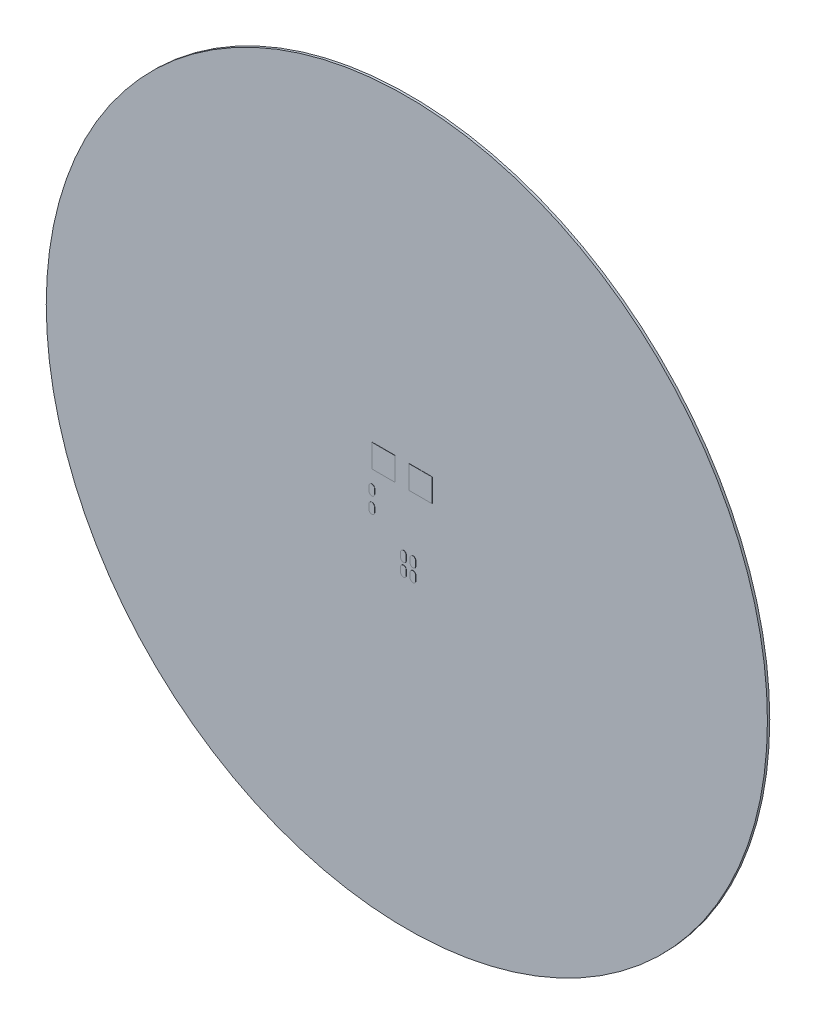
from build123d import *

# Parameters (mm, degrees)
SKETCH1_R           = 155
BOSS_EXTRUDE1_DEPTH = 1
SKETCH2_W           = 9.944482202
SKETCH2_H           = 9.944482203
BOSS_EXTRUDE2_DEPTH = 0.1


with BuildPart() as part:
    # Sketch1 → Boss-Extrude1 (new body)
    with BuildSketch(Plane.XY):
        Circle(SKETCH1_R)
    extrude(amount=BOSS_EXTRUDE1_DEPTH)

    # Sketch2 → Boss-Extrude2 (add)
    with BuildSketch(Plane.XY.offset(1)):
        with Locations((-10, 13.832433297)):
            Rectangle(SKETCH2_W, SKETCH2_H)
        with Locations((6, 13.832433297)):
            Rectangle(SKETCH2_W, SKETCH2_H)
        with BuildLine():
            Line((-13.779336212, 2.051462451), (-13.779336212, 0))
            ThreePointArc((-13.779336212, 0), (-14.972241101, -1.19290489), (-16.165145991, 0))
            Line((-16.165145991, 0), (-16.165145991, 2.051462451))
            ThreePointArc((-16.165145991, 2.051462451), (-14.972241101, 3.244367341), (-13.779336212, 2.051462451))
        make_face()
        with BuildLine():
            Line((-16.165145991, -6.802865473), (-16.165145991, -4.751403022))
            ThreePointArc((-16.165145991, -4.751403022), (-14.972241101, -3.558498133), (-13.779336212, -4.751403022))
            Line((-13.779336212, -4.751403022), (-13.779336212, -6.802865473))
            ThreePointArc((-13.779336212, -6.802865473), (-14.972241101, -7.995770363), (-16.165145991, -6.802865473))
        make_face()
        with BuildLine():
            Line((-0.185839603, -15.881052977), (-0.185839603, -17.932515427))
            ThreePointArc((-0.185839603, -17.932515427), (-1.378744492, -19.125420317), (-2.571649382, -17.932515427))
            Line((-2.571649382, -17.932515427), (-2.571649382, -15.881052977))
            ThreePointArc((-2.571649382, -15.881052977), (-1.378744492, -14.688148087), (-0.185839603, -15.881052977))
        make_face()
        with BuildLine():
            Line((3.900067015, -15.881052977), (3.900067015, -17.932515427))
            ThreePointArc((3.900067015, -17.932515427), (2.707162125, -19.125420317), (1.514257236, -17.932515427))
            Line((1.514257236, -17.932515427), (1.514257236, -15.881052977))
            ThreePointArc((1.514257236, -15.881052977), (2.707162125, -14.688148087), (3.900067015, -15.881052977))
        make_face()
        with BuildLine():
            Line((-0.185839603, -21.393622173), (-0.185839603, -23.445084624))
            ThreePointArc((-0.185839603, -23.445084624), (-1.378744492, -24.637989514), (-2.571649382, -23.445084624))
            Line((-2.571649382, -23.445084624), (-2.571649382, -21.393622173))
            ThreePointArc((-2.571649382, -21.393622173), (-1.378744492, -20.200717283), (-0.185839603, -21.393622173))
        make_face()
        with BuildLine():
            Line((1.514257236, -23.445084624), (1.514257236, -21.393622173))
            ThreePointArc((1.514257236, -21.393622173), (2.707162125, -20.200717283), (3.900067015, -21.393622173))
            Line((3.900067015, -21.393622173), (3.900067015, -23.445084624))
            ThreePointArc((3.900067015, -23.445084624), (2.707162125, -24.637989514), (1.514257236, -23.445084624))
        make_face()
    extrude(amount=BOSS_EXTRUDE2_DEPTH)


solid = part.part
